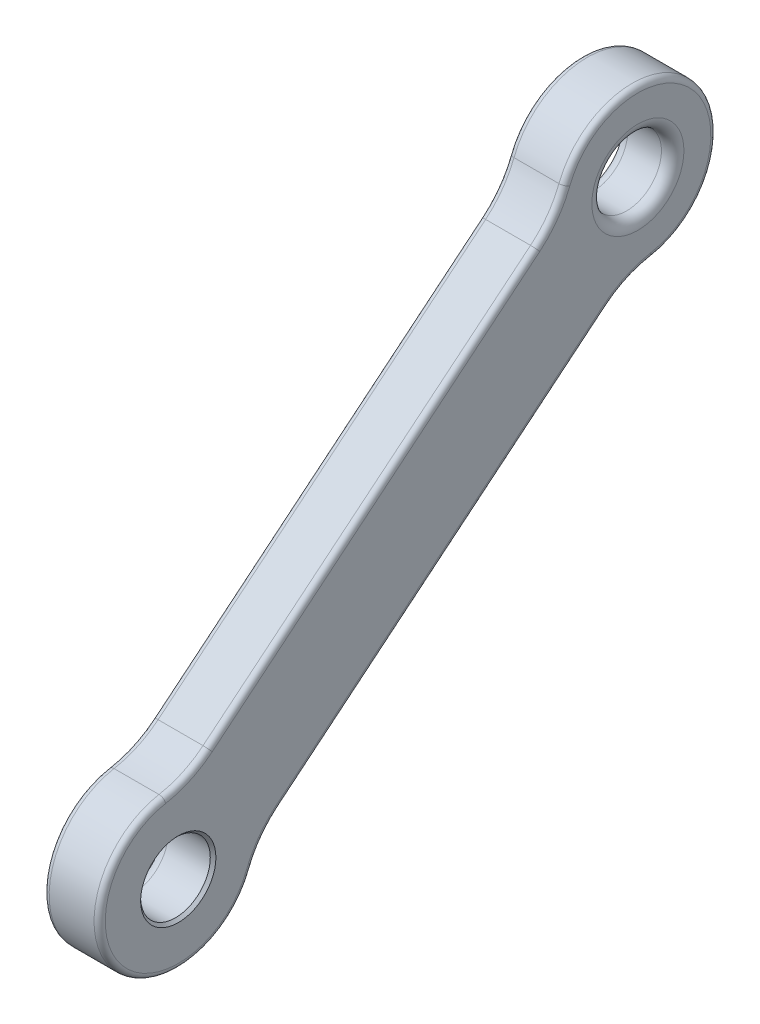
from build123d import *

# Parameters (mm, degrees)
SKETCH2_R           = 6.2
BOSS_EXTRUDE1_DEPTH = 10
FILLET1_R           = 1
FILLET2_R           = 2
CHAMFER1_SIZE       = 0.5
CUT_EXTRUDE1_DEPTH  = 3
FILLET3_R           = 0.2


with BuildPart() as part:
    # Sketch2 → Boss-Extrude1 (new body)
    with BuildSketch(Plane.YZ):
        with BuildLine():
            Line((65.394063388, -63.737968879), (17.399782703, -5.408101505))
            ThreePointArc((17.399782703, -5.408101505), (15.086755871, -1.719482899), (13.78649678, 2.435673734))
            ThreePointArc((13.78649678, 2.435673734), (-8.895253342, 10.810849549), (-5.045305661, -13.059283701))
            ThreePointArc((-5.045305661, -13.059283701), (-1.218367299, -15.135468453), (1.955711918, -18.11560628))
            Line((1.955711918, -18.11560628), (49.949992603, -76.445473653))
            ThreePointArc((49.949992603, -76.445473653), (52.263019434, -80.13409226), (53.563278526, -84.289248892))
            ThreePointArc((53.563278526, -84.289248892), (76.245028648, -92.664424708), (72.395080967, -68.794291457))
            ThreePointArc((72.395080967, -68.794291457), (68.568142605, -66.718106706), (65.394063388, -63.737968879))
        make_face()
        with Locations(Location((0, 0, 0), (0, 0, 270))):
            Circle(SKETCH2_R, mode=Mode.SUBTRACT)
        with Locations(Location((67.349775306, -81.853575159, 0), (0, 0, 270))):
            Circle(SKETCH2_R, mode=Mode.SUBTRACT)
    extrude(amount=BOSS_EXTRUDE1_DEPTH)

    # Fillet1
    fillet1_edges = [part.edges().sort_by_distance(p)[0] for p in [
        (0, -8.895253342, 10.810849549),
        (0, 15.086755871, -1.719482899),
        (0, 41.396923045, -34.573035192),
        (0, 68.568142605, -66.718106706),
        (10, 15.086755871, -1.719482899),
        (10, -8.895253342, 10.810849549),
        (10, -1.218367299, -15.135468453),
        (10, 25.952852261, -47.280539967),
        (10, 52.263019434, -80.13409226),
        (10, 76.245028648, -92.664424708),
        (10, 68.568142605, -66.718106706),
        (0, 76.245028648, -92.664424708),
        (10, 41.396923045, -34.573035192),
        (0, 52.263019434, -80.13409226),
        (0, 25.952852261, -47.280539967),
        (0, -1.218367299, -15.135468453),
    ]]
    fillet(fillet1_edges, radius=FILLET1_R)

    # Fillet2
    fillet2_edges = [part.edges().sort_by_distance(p)[0] for p in [
        (0, 0, 6.2),
        (0, 67.349775306, -75.653575159),
        (10, 67.349775306, -75.653575159),
    ]]
    fillet(fillet2_edges, radius=FILLET2_R)

    # Chamfer1
    chamfer1_edges = [part.edges().sort_by_distance(p)[0] for p in [
        (10, 0, 6.2),
    ]]
    chamfer(chamfer1_edges, length=CHAMFER1_SIZE)

    # Sketch3 → Cut-Extrude1 (cut)
    with BuildSketch(Plane(origin=(0, 0, 0), x_dir=(0, -1, 0), z_dir=(-1, 0, 0))):
        with BuildLine():
            Line((-65.289987943, -76.005731452), (-64.146312514, -74.615765081))
            ThreePointArc((-64.146312514, -74.615765081), (-64.01122225, -74.543778429), (-63.864796758, -74.588399421))
            Line((-63.864796758, -74.588399421), (-60.891813132, -77.03459409))
            ThreePointArc((-60.891813132, -77.03459409), (-60.81982648, -77.169684354), (-60.864447472, -77.316109846))
            Line((-60.864447472, -77.316109846), (-62.008122902, -78.706076216))
            ThreePointArc((-62.008122902, -78.706076216), (-63.410448826, -77.065913215), (-65.289987943, -76.005731452))
        make_face()
        with BuildLine():
            Line((-72.69142771, -85.001074101), (-73.83510314, -86.391040472))
            ThreePointArc((-73.83510314, -86.391040472), (-73.879724132, -86.537465963), (-73.80773748, -86.672556227))
            Line((-73.80773748, -86.672556227), (-70.834753854, -89.118750896))
            ThreePointArc((-70.834753854, -89.118750896), (-70.688328362, -89.163371888), (-70.553238098, -89.091385236))
            Line((-70.553238098, -89.091385236), (-69.409562668, -87.701418866))
            ThreePointArc((-69.409562668, -87.701418866), (-71.289101786, -86.641237102), (-72.69142771, -85.001074101))
        make_face()
    extrude(amount=-CUT_EXTRUDE1_DEPTH, mode=Mode.SUBTRACT)

    # Fillet3
    fillet3_edges = [part.edges().sort_by_distance(p)[0] for p in [
        (0.035573282, 72.321245667, -87.895653562),
        (0.006739231, 70.688016205, -89.163341307),
        (0.677399809, 69.74590727, -88.110195406),
        (0.006739231, 73.879754243, -86.537153761),
        (0.677399809, 73.027772312, -85.409850642),
        (0.677399809, 61.671778299, -78.297299676),
        (0.006739232, 60.819796369, -77.169996556),
        (0.035573282, 62.378304945, -75.811496755),
        (0.006739231, 64.011534407, -74.543809011),
        (0.677399809, 64.953643341, -75.596954911),
        (2.5, 62.008122902, -78.706076216),
        (3, 63.410448826, -77.065913215),
        (3, 64.718150228, -75.310748266),
        (2.5, 65.289987943, -76.005731452),
        (3, 64.01122225, -74.543778429),
        (3, 62.378304945, -75.811496756),
        (3, 60.81982648, -77.169684354),
        (3, 61.436285187, -78.011093031),
        (2.5, 72.69142771, -85.001074101),
        (3, 71.289101786, -86.641237102),
        (3, 73.879724132, -86.537465963),
        (3, 73.263265425, -85.696057286),
        (3, 69.981400383, -88.396402051),
        (2.5, 69.409562668, -87.701418866),
        (3, 70.688328362, -89.163371888),
        (3, 72.321245667, -87.895653562),
    ]]
    fillet(fillet3_edges, radius=FILLET3_R)


solid = part.part
